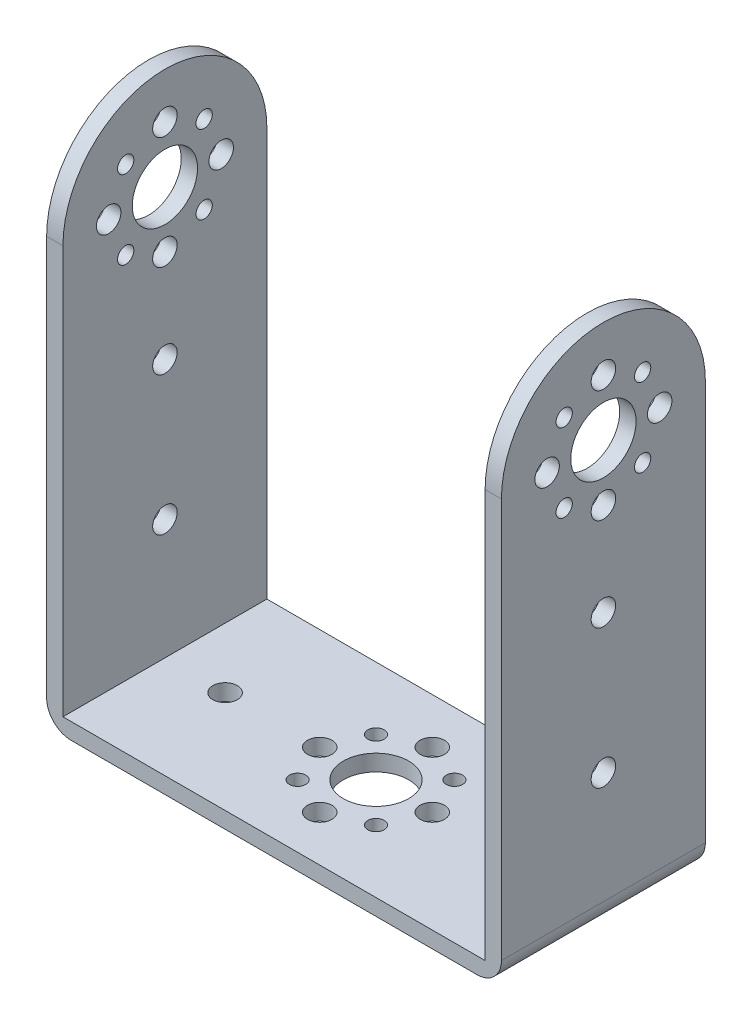
from build123d import *

# Parameters (mm, degrees)
SKETCH1_W           = 55.75
SKETCH1_H           = 25
SKETCH1_R           = 4
SKETCH1_R_2         = 1.5
SKETCH1_R_3         = 1
BOSS_EXTRUDE1_DEPTH = 2
SKETCH2_W           = 2
SKETCH2_H           = 25
BOSS_EXTRUDE2_DEPTH = 62.5
FILLET1_R           = 3
CUT_EXTRUDE1_DEPTH  = 56
SKETCH4_R           = 4
SKETCH4_R_2         = 1.5
SKETCH4_R_3         = 1
CUT_EXTRUDE2_DEPTH  = 56


with BuildPart() as part:
    # Sketch1 → Boss-Extrude1 (new body)
    with BuildSketch(Plane(origin=(0, 0, 0), x_dir=(1, 0, 0), z_dir=(0, 1, 0))):
        with Locations((27.875, 12.5)):
            Rectangle(SKETCH1_W, SKETCH1_H)
        with Locations(Location((27.875, 12.5, 0), (0, 0, 270))):
            Circle(SKETCH1_R, mode=Mode.SUBTRACT)
        with Locations(Location((27.875, 19.4, 0), (0, 0, 270))):
            Circle(SKETCH1_R_2, mode=Mode.SUBTRACT)
        with Locations(Location((34.775, 12.5, 0), (0, 0, 270))):
            Circle(SKETCH1_R_2, mode=Mode.SUBTRACT)
        with Locations(Location((27.875, 5.6, 0), (0, 0, 270))):
            Circle(SKETCH1_R_2, mode=Mode.SUBTRACT)
        with Locations(Location((20.975, 12.5, 0), (0, 0, 270))):
            Circle(SKETCH1_R_2, mode=Mode.SUBTRACT)
        with Locations(Location((32.683326112, 17.308326112, 0), (0, 0, 270))):
            Circle(SKETCH1_R_3, mode=Mode.SUBTRACT)
        with Locations(Location((32.683326112, 7.691673888, 0), (0, 0, 270))):
            Circle(SKETCH1_R_3, mode=Mode.SUBTRACT)
        with Locations(Location((23.066673888, 7.691673888, 0), (0, 0, 270))):
            Circle(SKETCH1_R_3, mode=Mode.SUBTRACT)
        with Locations(Location((23.066673888, 17.308326112, 0), (0, 0, 270))):
            Circle(SKETCH1_R_3, mode=Mode.SUBTRACT)
        with Locations(Location((46.375, 12.5, 0), (0, 0, 270))):
            Circle(SKETCH1_R_2, mode=Mode.SUBTRACT)
        with Locations(Location((9.375, 12.5, 0), (0, 0, 90))):
            Circle(SKETCH1_R_2, mode=Mode.SUBTRACT)
    extrude(amount=BOSS_EXTRUDE1_DEPTH)

    # Sketch2 → Boss-Extrude2 (add)
    with BuildSketch(Plane(origin=(0, 2, 0), x_dir=(1, 0, 0), z_dir=(0, 1, 0))):
        with Locations((1, 12.5)):
            Rectangle(SKETCH2_W, SKETCH2_H)
        with Locations((54.75, 12.5)):
            Rectangle(SKETCH2_W, SKETCH2_H)
    extrude(amount=BOSS_EXTRUDE2_DEPTH)

    # Fillet1
    fillet1_edges = [part.edges().sort_by_distance(p)[0] for p in [
        (55.75, 0, -12.5),
        (0, 0, -12.5),
    ]]
    fillet(fillet1_edges, radius=FILLET1_R)

    # Sketch3 → Cut-Extrude1 (cut)
    with BuildSketch(Plane(origin=(55.75, 0, 0), x_dir=(0, 0, -1), z_dir=(1, 0, 0))):
        with BuildLine():
            Line((12.5, 64.5), (0, 64.5))
            Line((0, 64.5), (0, 52))
            ThreePointArc((0, 52), (3.661165235, 60.838834765), (12.5, 64.5))
        make_face()
        with BuildLine():
            Line((25, 64.5), (12.5, 64.5))
            ThreePointArc((12.5, 64.5), (21.338834765, 60.838834765), (25, 52))
            Line((25, 52), (25, 64.5))
        make_face()
    extrude(amount=-CUT_EXTRUDE1_DEPTH, mode=Mode.SUBTRACT)

    # Sketch4 → Cut-Extrude2 (cut)
    with BuildSketch(Plane(origin=(55.75, 0, 0), x_dir=(0, 0, -1), z_dir=(1, 0, 0))):
        with Locations((12.5, 52)):
            Circle(SKETCH4_R)
        with Locations((5.6, 52)):
            Circle(SKETCH4_R_2)
        with Locations((12.5, 58.9)):
            Circle(SKETCH4_R_2)
        with Locations((19.4, 52)):
            Circle(SKETCH4_R_2)
        with Locations((12.5, 45.1)):
            Circle(SKETCH4_R_2)
        with Locations((7.691673888, 47.191673888)):
            Circle(SKETCH4_R_3)
        with Locations((12.5, 33.7)):
            Circle(SKETCH4_R_2)
        with Locations((12.5, 16.7)):
            Circle(SKETCH4_R_2)
        with Locations((7.691673888, 56.808326112)):
            Circle(SKETCH4_R_3)
        with Locations((17.308326112, 56.808326112)):
            Circle(SKETCH4_R_3)
        with Locations((17.308326112, 47.191673888)):
            Circle(SKETCH4_R_3)
    extrude(amount=-CUT_EXTRUDE2_DEPTH, mode=Mode.SUBTRACT)


solid = part.part
